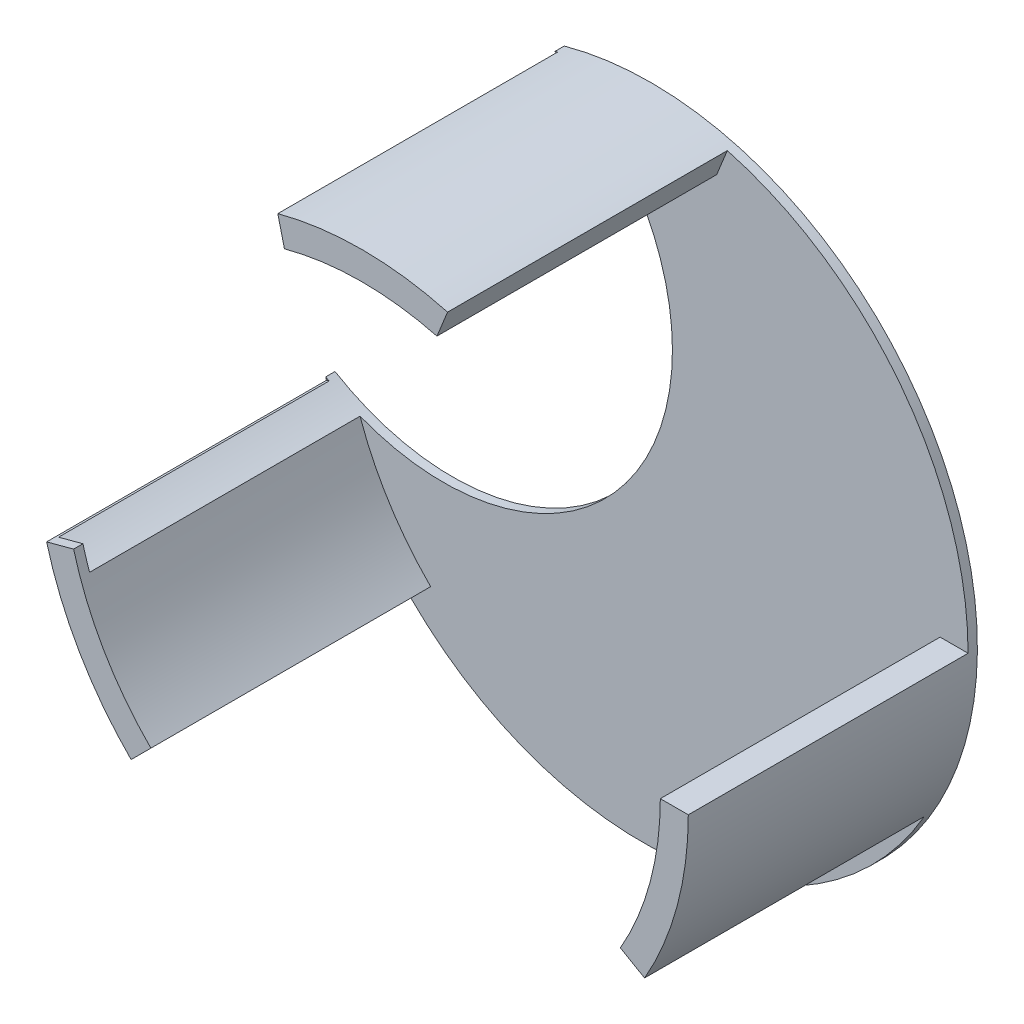
from build123d import *
from build123d.topology import SkipClean

# Parameters (mm, degrees)
SKETCH1_R           = 17.5
BOSS_EXTRUDE1_DEPTH = 0.5
BOSS_EXTRUDE2_DEPTH = 15
SKETCH3_R           = 12.279415491
CUT_EXTRUDE1_DEPTH  = 15


with BuildPart() as part:
    # Sketch1 → Boss-Extrude1 (new body)
    with BuildSketch(Plane.XY):
        Circle(SKETCH1_R)
    extrude(amount=BOSS_EXTRUDE1_DEPTH)

    # Sketch2 → Boss-Extrude2 (add)
    with SkipClean():  # the faces are left unmerged after this step: merging them gives an invalid solid
        with BuildSketch(Plane.XY.offset(0.5)):
            with BuildLine():
                ThreePointArc((15.155444566, -8.75), (16.90370196, -4.529333289), (17.5, 0))
                Line((17.5, 0), (16, 0))
                ThreePointArc((16, 0), (15.454813221, -4.141104722), (13.856406461, -8))
                Line((13.856406461, -8), (15.155444566, -8.75))
            make_face()
            with BuildLine():
                ThreePointArc((4.592982123, 16.886518742), (0.043911409, 17.499944908), (-4.508180458, 16.909355664))
                Line((-4.508180458, 16.909355664), (-4.152362122, 15.452168884))
                ThreePointArc((-4.152362122, 15.452168884), (-0.066810406, 16.000224085), (4.023175675, 15.486306593))
                Line((4.023175675, 15.486306593), (4.592982123, 16.886518742))
            make_face()
            with BuildLine():
                ThreePointArc((-15.454813221, -4.141104722), (-13.856406461, -8), (-11.313708499, -11.313708499))
                Line((-11.313708499, -11.313708499), (-12.374368671, -12.374368671))
                ThreePointArc((-12.374368671, -12.374368671), (-15.155444566, -8.75), (-16.90370196, -4.529333289))
                Line((-16.90370196, -4.529333289), (-15.454813221, -4.141104722))
            make_face()
        extrude(amount=BOSS_EXTRUDE2_DEPTH)

    # Sketch3 → Cut-Extrude1 (cut)
    with SkipClean():  # the faces are left unmerged after this step: merging them gives an invalid solid
        with BuildSketch(Plane(origin=(0, 0, 0), x_dir=(-1, 0, 0), z_dir=(0, 0, -1))):
            with Locations((10.630442789, 6.146359158)):
                Circle(SKETCH3_R)
        extrude(amount=-CUT_EXTRUDE1_DEPTH, mode=Mode.SUBTRACT)


solid = part.part
